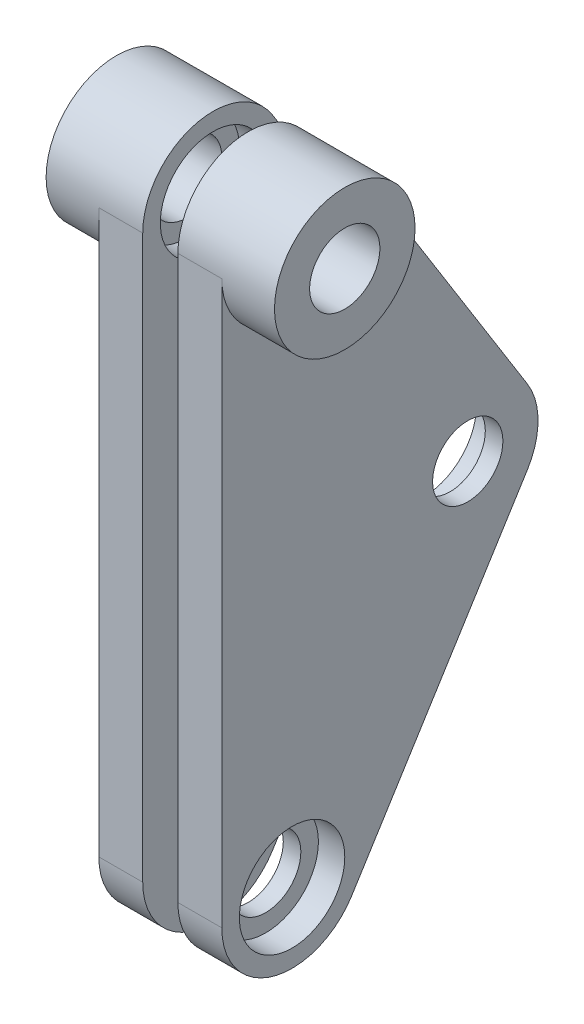
from build123d import *
from build123d.topology import SkipClean

# Parameters (mm, degrees)
EXTRUDE_1_DEPTH          = 2.5
EXTRUDE_START            = -3
SKETCH_1_4_R             = 4
EXTRUDE_2_DEPTH          = 3
CUT_EXTRUDE_1_DEPTH      = 44.965895874
CUT_EXTRUDE_1_DEPTH_BACK = 44.965895874
SKETCH_1_3_R             = 2
SKETCH_2_R               = 3
CUT_EXTRUDE_2_DEPTH      = 1.5
CUT_EXTRUDE_START        = -2.5
SKETCH_2_3_R             = 3
CUT_EXTRUDE_3_DEPTH      = 1.5


with BuildPart() as part:
    # 草图1 → 凸台-拉伸1 (new body)
    with BuildSketch(Plane(origin=(0, 0, 0), x_dir=(0, 0, -1), z_dir=(1, 0, 0))):
        with BuildLine():
            Line((17.391993216, -17.88000424), (7.391993216, -1.88000424))
            ThreePointArc((7.391993216, -1.88000424), (2.897269948, -0.155005015), (0, -4))
            Line((0, -4), (0, -36))
            ThreePointArc((0, -36), (2.897269948, -39.844994985), (7.391993216, -38.11999576))
            Line((7.391993216, -38.11999576), (17.391993216, -22.11999576))
            ThreePointArc((17.391993216, -22.11999576), (18, -20), (17.391993216, -17.88000424))
        make_face()
    extrude(amount=EXTRUDE_1_DEPTH)

    # 草图1<4> → 凸台-拉伸2 (add)
    with SkipClean():  # the faces are left unmerged after this step: merging them gives an invalid solid
        with BuildSketch(Plane(origin=(0, 0, 0), x_dir=(0, 0, -1), z_dir=(1, 0, 0)).offset(EXTRUDE_START)):
            with Locations(Location((4, -4, 0), (0, 0, 180))):
                Circle(SKETCH_1_4_R)
        extrude(amount=EXTRUDE_2_DEPTH)

    # 草图1<3> → 切除-拉伸1 (cut, two sides: drawn at the far end of the back side and taken through both)
    with SkipClean():  # the faces are left unmerged after this step: merging them gives an invalid solid
        with BuildSketch(Plane(origin=(0, 0, 0), x_dir=(0, 0, -1), z_dir=(1, 0, 0)).offset(-CUT_EXTRUDE_1_DEPTH_BACK)):
            with Locations((4, -4)):
                Circle(SKETCH_1_3_R)
            with Locations((14, -20)):
                Circle(SKETCH_1_3_R)
            with Locations((4, -36)):
                Circle(SKETCH_1_3_R)
        extrude(amount=CUT_EXTRUDE_1_DEPTH + CUT_EXTRUDE_1_DEPTH_BACK, mode=Mode.SUBTRACT)

    # 草图2 → 切除-拉伸2 (cut)
    with SkipClean():  # the faces are left unmerged after this step: merging them gives an invalid solid
        with BuildSketch(Plane(origin=(2.5, 0, 0), x_dir=(0, 0, -1), z_dir=(1, 0, 0))):
            with Locations((4, -4)):
                Circle(SKETCH_2_R)
            with Locations((14, -20)):
                Circle(SKETCH_2_R)
        extrude(amount=-CUT_EXTRUDE_2_DEPTH, mode=Mode.SUBTRACT)

    # 草图2<3> → 切除-拉伸3 (cut)
    with SkipClean():  # the faces are left unmerged after this step: merging them gives an invalid solid
        with BuildSketch(Plane(origin=(2.5, 0, 0), x_dir=(0, 0, -1), z_dir=(1, 0, 0)).offset(CUT_EXTRUDE_START)):
            with Locations((4, -36)):
                Circle(SKETCH_2_3_R)
        extrude(amount=CUT_EXTRUDE_3_DEPTH, mode=Mode.SUBTRACT)


with BuildPart() as body_2:
    # 镜向2: mirrored copy
    add(part.part.mirror(Plane(origin=(3.5, 0, 0), x_dir=(0, 0, 1), z_dir=(1, 0, 0))))


solid = Compound([part.part, body_2.part])
